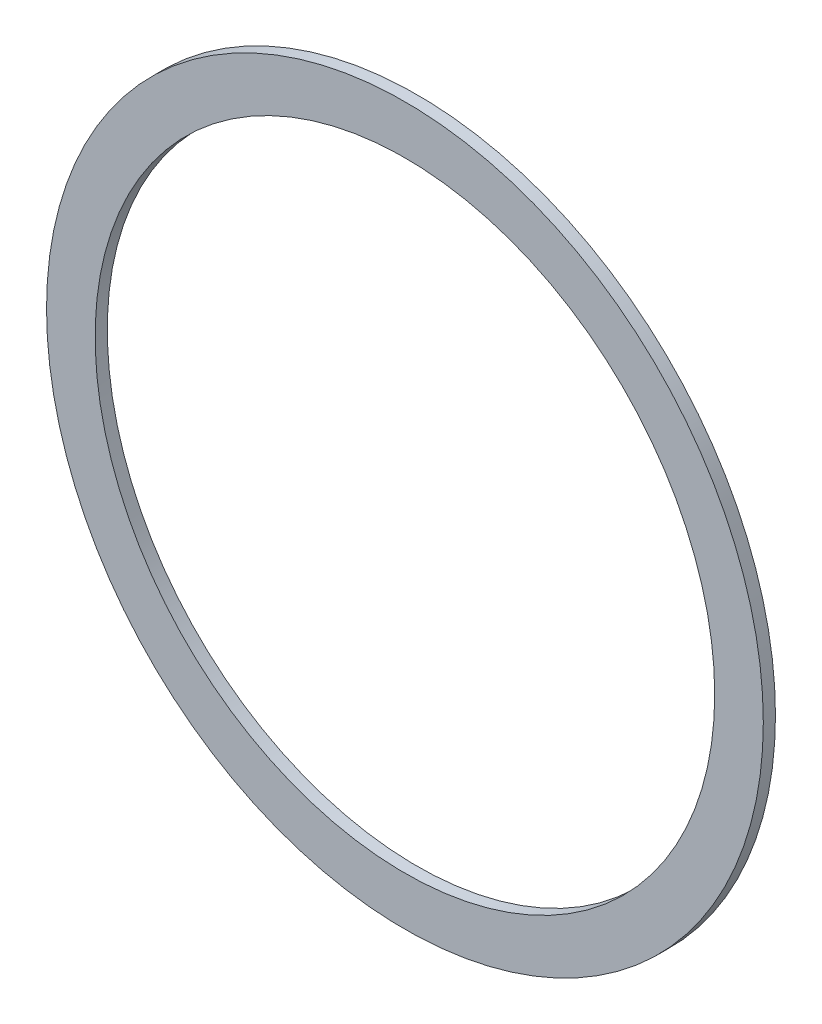
from build123d import *

# Parameters (mm, degrees)
SKETCH1_R           = 295
SKETCH1_R_2         = 255
BOSS_EXTRUDE1_DEPTH = 5


with BuildPart() as part:
    # Sketch1 → Boss-Extrude1 (new, symmetric)
    with BuildSketch(Plane.XY):
        Circle(SKETCH1_R)
        Circle(SKETCH1_R_2, mode=Mode.SUBTRACT)
    extrude(amount=BOSS_EXTRUDE1_DEPTH, both=True)


solid = part.part
